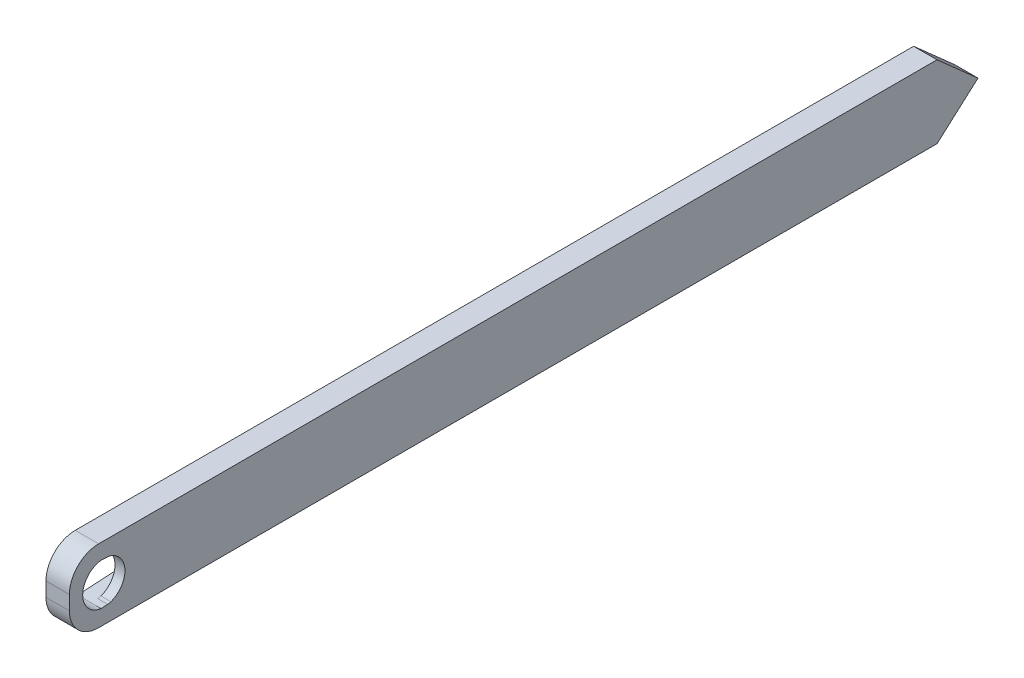
from build123d import *

# Parameters (mm, degrees)
SKETCH1_W           = 135.25
SKETCH1_H           = 12.42
BOSS_EXTRUDE1_DEPTH = 4
CUT_EXTRUDE1_DEPTH  = 156.797364869
CUT_EXTRUDE2_DEPTH  = 2.3
FILLET1_R           = 5
FILLET2_R           = 2


with BuildPart() as part:
    # Sketch1 → Boss-Extrude1 (new body)
    with BuildSketch(Plane(origin=(0, 0, 0), x_dir=(0, 0, -1), z_dir=(1, 0, 0))):
        with Locations((67.625, 6.21)):
            Rectangle(SKETCH1_W, SKETCH1_H)
        Polygon((148.25, 0), (135.25, 0), (135.25, 12.42), (148.25, 12.42), (155.25, 6.21), align=None)
    extrude(amount=BOSS_EXTRUDE1_DEPTH)

    # Sketch7 → Cut-Extrude1 (cut, through all)
    with BuildSketch(Plane.ZY):
        with BuildLine():
            ThreePointArc((-2.27, 6.21), (-3.168108515, 8.592801832), (-5.415564859, 9.79))
            Line((-5.415564859, 9.79), (-6.76734979, 9.709244254))
            ThreePointArc((-6.76734979, 9.709244254), (-9.49, 6.21), (-6.76734979, 2.710755746))
            Line((-6.76734979, 2.710755746), (-5.415564859, 2.63))
            ThreePointArc((-5.415564859, 2.63), (-3.168108515, 3.827198168), (-2.27, 6.21))
        make_face()
    extrude(amount=-CUT_EXTRUDE1_DEPTH, mode=Mode.SUBTRACT)

    # Sketch7<3> → Cut-Extrude2 (cut)
    with BuildSketch(Plane.ZY):
        with BuildLine():
            ThreePointArc((-6.76734979, 2.710755746), (-9.49, 6.21), (-6.76734979, 9.709244254))
            Line((-6.76734979, 9.709244254), (-23.410182873, 8.715))
            ThreePointArc((-23.410182873, 8.715), (-25.77, 6.21), (-23.410182873, 3.705))
            Line((-23.410182873, 3.705), (-6.76734979, 2.710755746))
        make_face()
    extrude(amount=-CUT_EXTRUDE2_DEPTH, mode=Mode.SUBTRACT)

    # Fillet1
    fillet1_edges = [part.edges().sort_by_distance(p)[0] for p in [
        (2, 0, 0),
        (2, 12.42, 0),
    ]]
    fillet(fillet1_edges, radius=FILLET1_R)

    # Fillet2
    fillet2_edges = [part.edges().sort_by_distance(p)[0] for p in [
        (3.15, 9.709244254, -6.76734979),
        (3.15, 2.710755746, -6.76734979),
    ]]
    fillet(fillet2_edges, radius=FILLET2_R)


solid = part.part
